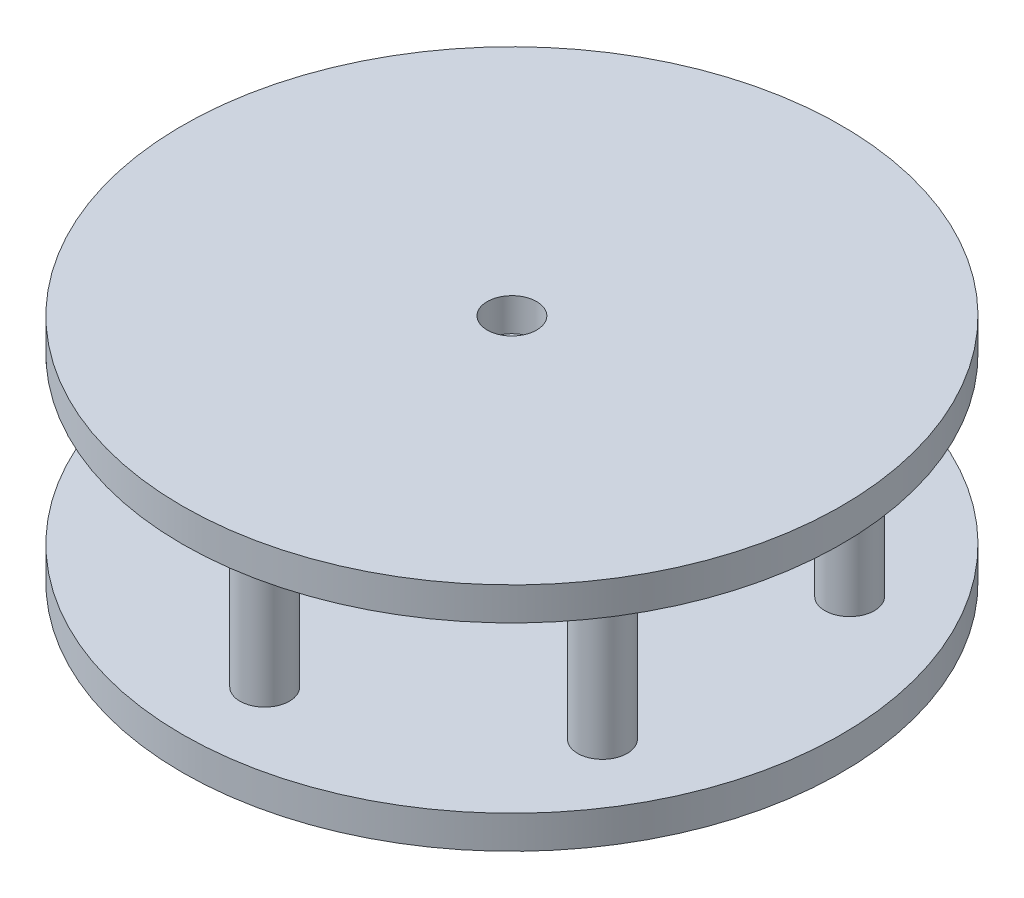
from build123d import *

# Parameters (mm, degrees)
SKETCH1_R           = 50.789558068
BOSS_EXTRUDE1_DEPTH = 5.08
SKETCH3_R           = 3.813733887
BOSS_EXTRUDE2_DEPTH = 25.4
CIRPATTERN1_COUNT   = 6
SKETCH4_R           = 50.789558068
BOSS_EXTRUDE3_DEPTH = 5.08
SKETCH6_R           = 3.81
CUT_EXTRUDE1_DEPTH  = 81.147813554


with BuildPart() as part:
    # Sketch1 → Boss-Extrude1 (new body)
    with BuildSketch(Plane(origin=(0, 0, 0), x_dir=(1, 0, 0), z_dir=(0, 1, 0))):
        with Locations(Location((0, 0, 0), (0, 0, 270))):
            Circle(SKETCH1_R)
    extrude(amount=BOSS_EXTRUDE1_DEPTH)

    # Sketch3 → Boss-Extrude2 (add)
    with BuildSketch(Plane(origin=(0, 5.08, 0), x_dir=(1, 0, 0), z_dir=(0, 1, 0))):
        with Locations(Location((0, 38.1, 0), (0, 0, 270))):
            Circle(SKETCH3_R)
    boss_extrude2 = extrude(amount=BOSS_EXTRUDE2_DEPTH)

    # CirPattern1: Boss-Extrude2 ×6 about axis
    cirpattern1_axis = Axis((0, 0, 0), (0, 1, 0))
    for i in range(1, CIRPATTERN1_COUNT):
        add(boss_extrude2.rotate(cirpattern1_axis, i * 360 / CIRPATTERN1_COUNT))

    # Sketch4 → Boss-Extrude3 (add)
    with BuildSketch(Plane(origin=(0, 30.48, 0), x_dir=(1, 0, 0), z_dir=(0, 1, 0))):
        with Locations(Location((0, 0, 0), (0, 0, 270))):
            Circle(SKETCH4_R)
    extrude(amount=BOSS_EXTRUDE3_DEPTH)

    # Sketch6 → Cut-Extrude1 (cut, through all)
    with BuildSketch(Plane(origin=(0, 35.56, 0), x_dir=(1, 0, 0), z_dir=(0, 1, 0))):
        with Locations(Location((0, 0, 0), (0, 0, 270))):
            Circle(SKETCH6_R)
    extrude(amount=-CUT_EXTRUDE1_DEPTH, mode=Mode.SUBTRACT)


solid = part.part
